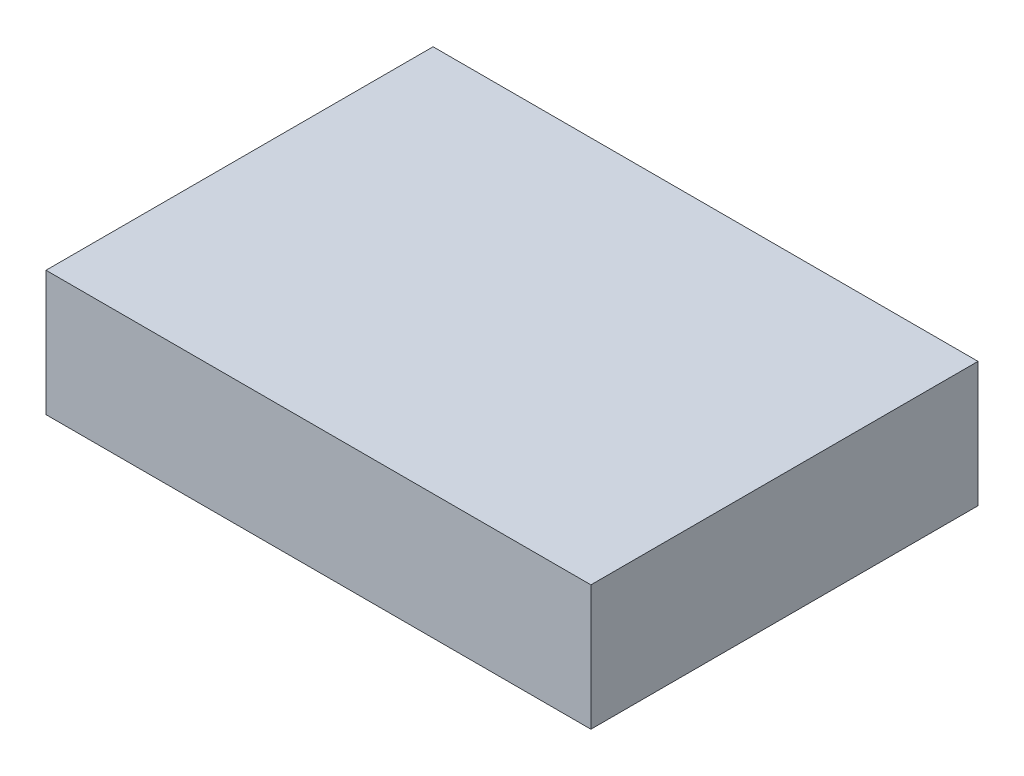
from build123d import *

# Parameters (mm, degrees)
SKETCH1_W           = 915
SKETCH1_H           = 650
BOSS_EXTRUDE1_DEPTH = 210


with BuildPart() as part:
    # Sketch1 → Boss-Extrude1 (new body)
    with BuildSketch(Plane(origin=(0, 0, 0), x_dir=(1, 0, 0), z_dir=(0, 1, 0))):
        with Locations((0, 325)):
            Rectangle(SKETCH1_W, SKETCH1_H)
    extrude(amount=-BOSS_EXTRUDE1_DEPTH)


solid = part.part
